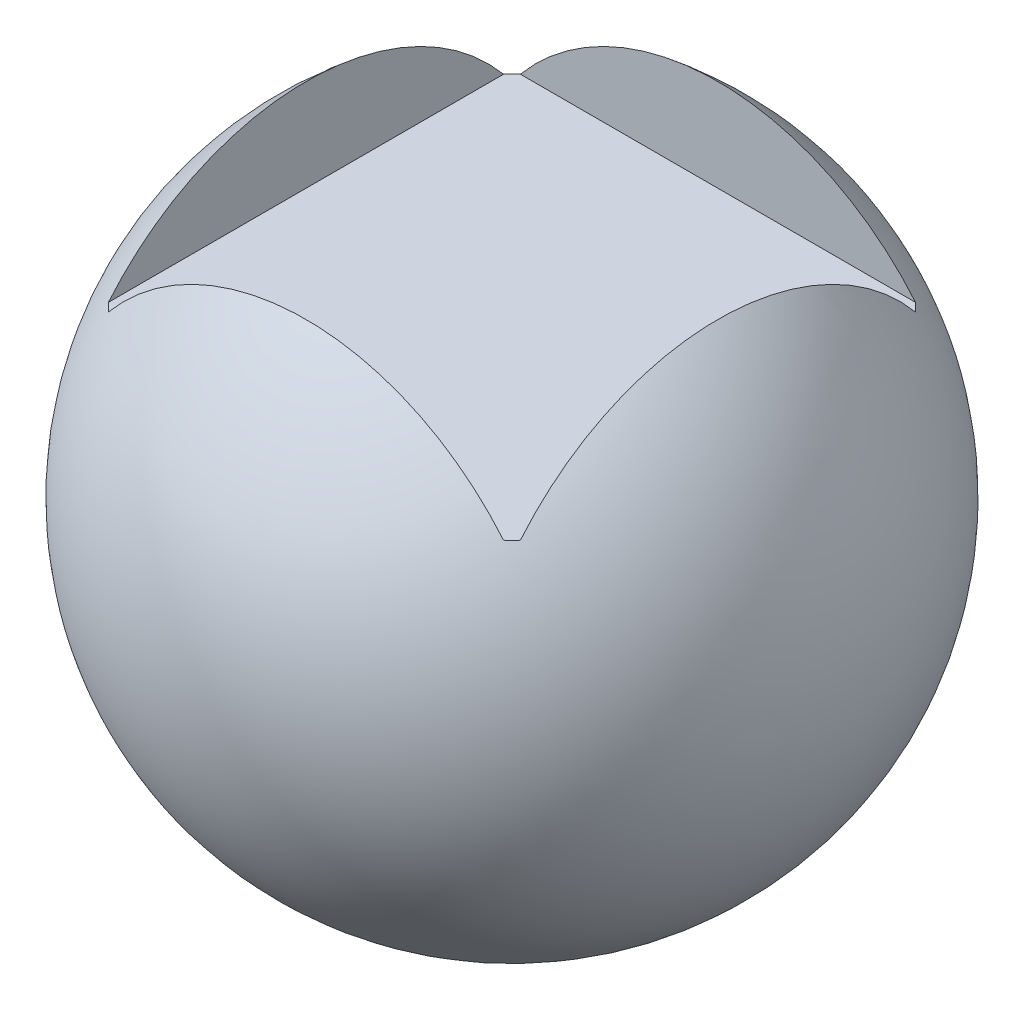
from build123d import *

# Parameters (mm, degrees)
SKETCH2_W          = 25
SKETCH2_H          = 25
CUT_EXTRUDE1_DEPTH = 10


with BuildPart() as part:
    # Sketch1 → Revolve1 (revolve)
    with BuildSketch(Plane(origin=(0, 0, 0), x_dir=(1, 0, 0), z_dir=(0, 1, 0))):
        with BuildLine():
            Line((0, 20), (0, -20))
            ThreePointArc((0, -20), (-20, 0), (0, 20))
        make_face()
    revolve(axis=Axis((0, 0, -88.597810796), (0, 0, 1)))

    # Sketch2 → Cut-Extrude1 (cut)
    with BuildSketch(Plane(origin=(0, 10, 0), x_dir=(1, 0, 0), z_dir=(0, 1, 0))):
        Rectangle(SKETCH2_W, SKETCH2_H)
    extrude(amount=CUT_EXTRUDE1_DEPTH, mode=Mode.SUBTRACT)


solid = part.part
